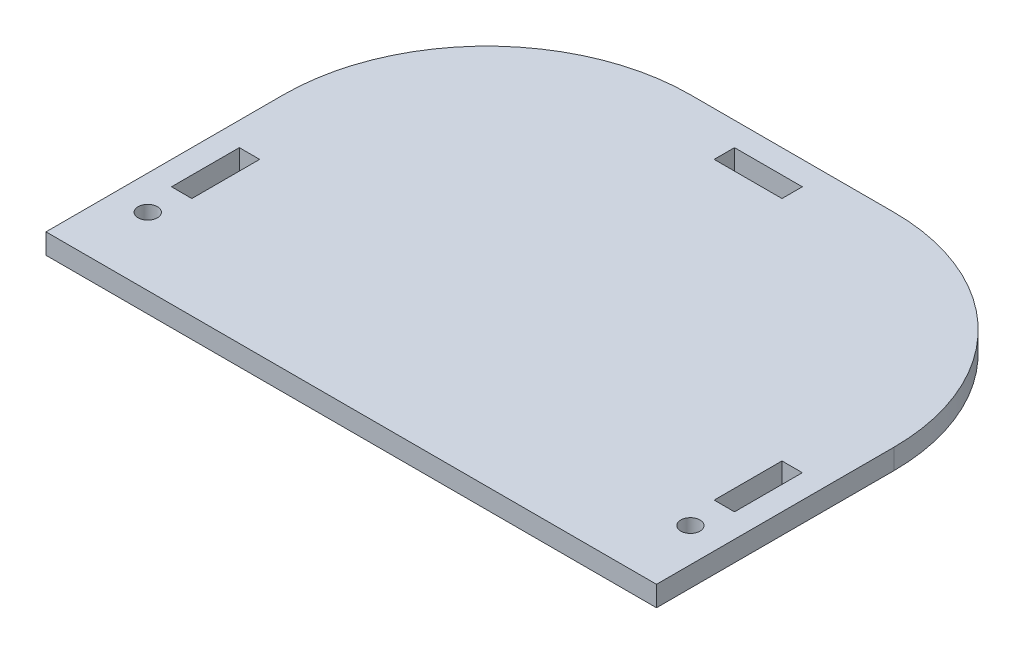
from build123d import *

# Parameters (mm, degrees)
SKETCH1_W           = 90
SKETCH1_H           = 65
SKETCH1_R           = 1.425
SKETCH1_W_2         = 10
SKETCH1_H_2         = 3
SKETCH1_W_3         = 3
SKETCH1_H_3         = 10
BOSS_EXTRUDE1_DEPTH = 3
FILLET1_R           = 30


with BuildPart() as part:
    # Sketch1 → Boss-Extrude1 (new body)
    with BuildSketch(Plane(origin=(0, 0, 0), x_dir=(1, 0, 0), z_dir=(0, 1, 0))):
        with Locations((0, 27.5)):
            Rectangle(SKETCH1_W, SKETCH1_H)
        with Locations(Location((-40, 5, 0), (0, 0, 270))):
            Circle(SKETCH1_R, mode=Mode.SUBTRACT)
        with Locations(Location((40, 5, 0), (0, 0, 270))):
            Circle(SKETCH1_R, mode=Mode.SUBTRACT)
        with Locations((0, 55)):
            Rectangle(SKETCH1_W_2, SKETCH1_H_2, mode=Mode.SUBTRACT)
        with Locations((-40, 15)):
            Rectangle(SKETCH1_W_3, SKETCH1_H_3, mode=Mode.SUBTRACT)
        with Locations((40, 15)):
            Rectangle(SKETCH1_W_3, SKETCH1_H_3, mode=Mode.SUBTRACT)
    extrude(amount=BOSS_EXTRUDE1_DEPTH)

    # Fillet1
    fillet1_edges = [part.edges().sort_by_distance(p)[0] for p in [
        (-45, 1.5, -60),
        (45, 1.5, -60),
    ]]
    fillet(fillet1_edges, radius=FILLET1_R)


solid = part.part
